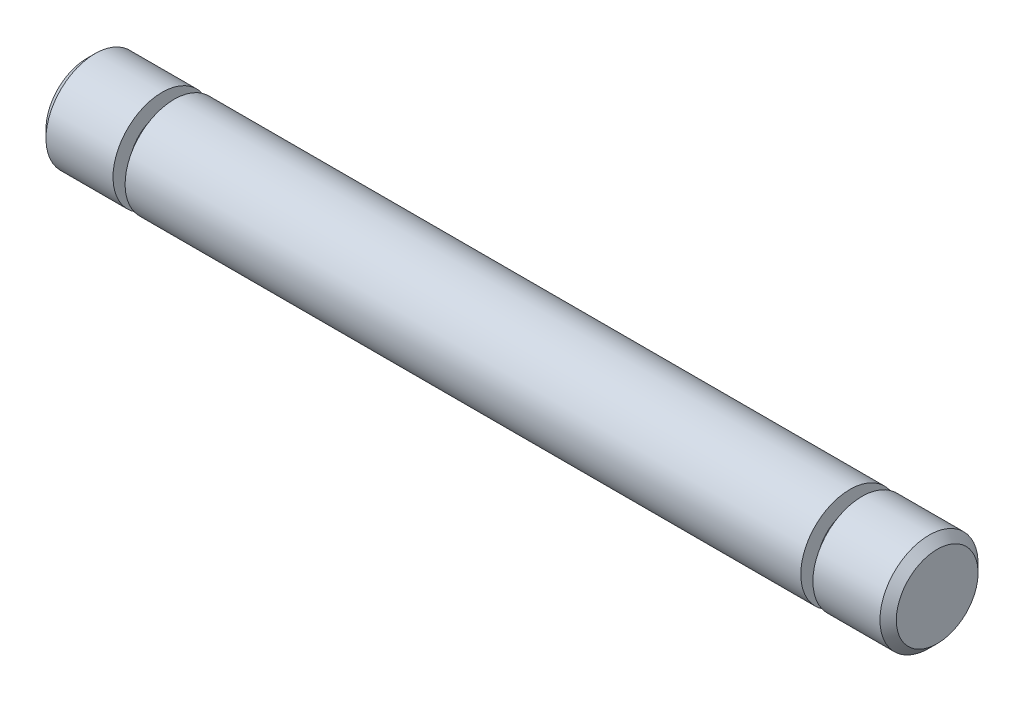
from build123d import *

# Parameters (mm, degrees)
ESQUISSE1_W     = 52
ESQUISSE1_H     = 3
CHANFREIN1_SIZE = 0.5
ESQUISSE3_W     = 0.74
ESQUISSE3_H     = 1


with BuildPart() as part:
    # Esquisse1 → Révolution1 (revolve)
    with BuildSketch(Plane.XY, mode=Mode.PRIVATE) as r_volution1_sk:
        with Locations((0, 1.5)):
            Rectangle(ESQUISSE1_W, ESQUISSE1_H)
    revolve(r_volution1_sk.sketch.rotate(Axis((0, 0, 0), (1, 0, 0)), 90), axis=Axis((0, 0, 0), (1, 0, 0)))

    # Chanfrein1
    chanfrein1_edges = [part.edges().sort_by_distance(p)[0] for p in [
        (26, 0, -3),
        (-26, 0, -3),
    ]]
    chamfer(chanfrein1_edges, length=CHANFREIN1_SIZE)

    # Esquisse3 → Enlèvement de matière-Révolution1 (revolve, cut)
    with BuildSketch(Plane.XY):
        with Locations((-21.03, 2.5)):
            Rectangle(ESQUISSE3_W, ESQUISSE3_H)
        with Locations((21.03, 2.5)):
            Rectangle(ESQUISSE3_W, ESQUISSE3_H)
    revolve(axis=Axis((0, 0, 0), (-1, 0, 0)), mode=Mode.SUBTRACT)


solid = part.part
